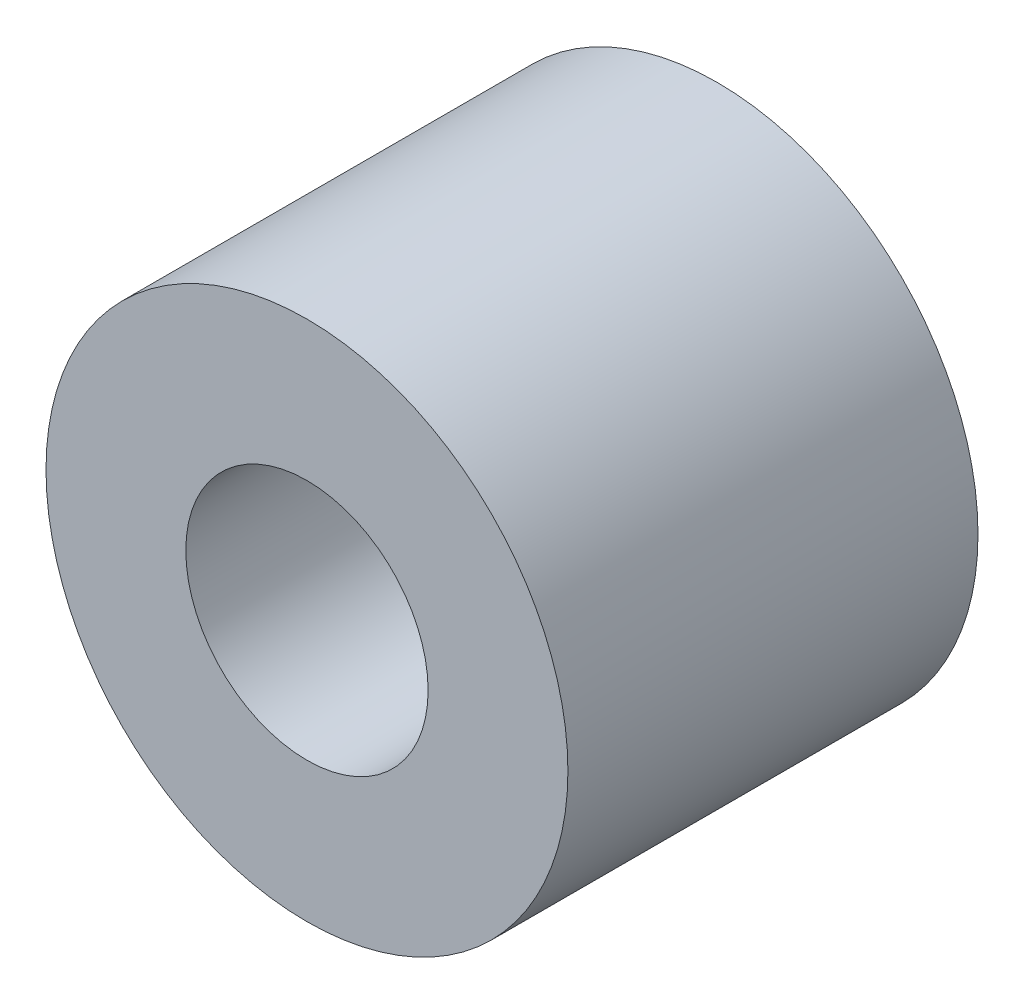
from build123d import *

# Parameters (mm, degrees)
ESQUISSE1_R        = 7
ESQUISSE1_R_2      = 3.25
BOSS_EXTRU_1_DEPTH = 11


with BuildPart() as part:
    # Esquisse1 → Boss.-Extru.1 (new body)
    with BuildSketch(Plane.XY):
        Circle(ESQUISSE1_R)
        Circle(ESQUISSE1_R_2, mode=Mode.SUBTRACT)
    extrude(amount=BOSS_EXTRU_1_DEPTH)


solid = part.part
